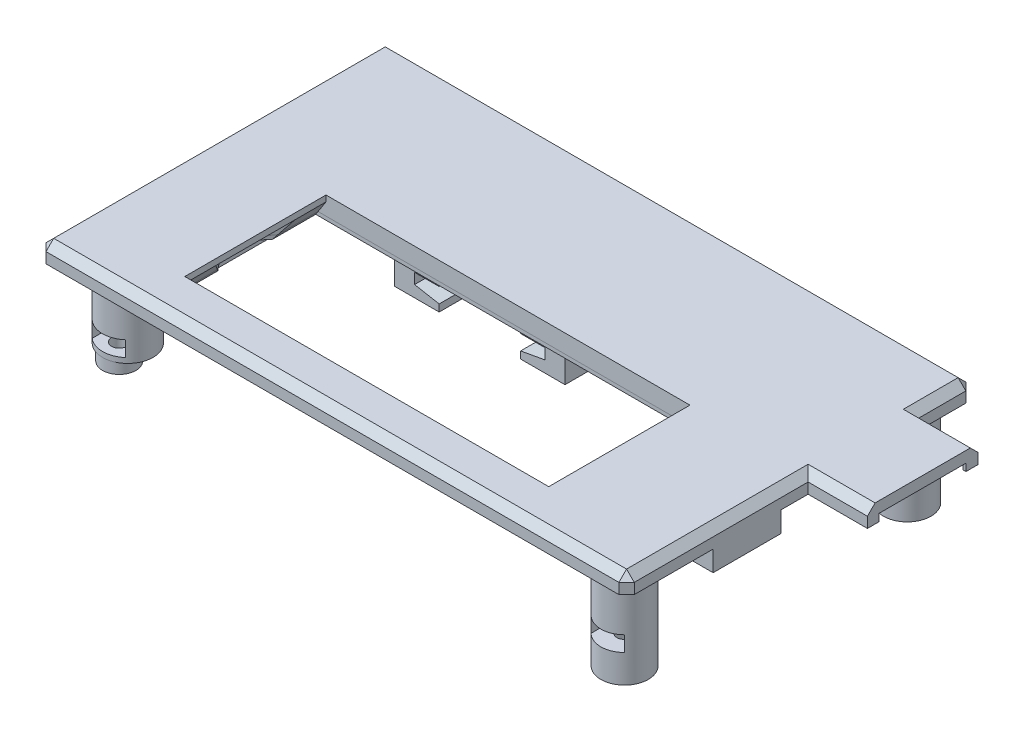
from build123d import *

# Parameters (mm, degrees)
SKETCH1_W                      = 116.713
SKETCH1_H                      = 68.834
BOSS_EXTRUDE1_DEPTH            = 3.629025
SKETCH32_W                     = 82.296
SKETCH32_H                     = 38.354
BOSS_EXTRUDE2_DEPTH            = 2.3622
SKETCH3_W                      = 72.2122
SKETCH3_H                      = 28.0162
LCD_WINDOW_DEPTH               = 122.968649856
LCD_BACKLIGHT_COVER_DEPTH      = 4.8006
SKETCH23_R                     = 1.016
LCD_MOUNTING_SCREW_HOLES_DEPTH = 4.975225
SKETCH8_W                      = 80.518
SKETCH8_H                      = 36.576
LCD_FACE_DEPTH                 = 122.898705176
SKETCH7_W                      = 96.6343
SKETCH7_H                      = 65.1764
SKETCH7_W_2                    = 95.0595
SKETCH7_H_2                    = 63.6016
RIDGE_INTO_BASE_DEPTH          = 1.190625
CLEAR_TILTED_LCD_DEPTH         = 28.0162
SKETCH5_W                      = 14.986
SKETCH5_H                      = 17.2212
F_9_PIN_IN_DEPTH               = 1.27
SKETCH4_W                      = 15.089010024
SKETCH4_H                      = 13.462
F_4_PIN_BACK_1_DEPTH           = 4.064
F_9_START                      = -15.6718
SKETCH40_W                     = 20.32
SKETCH40_H                     = 16.2687
F_9_PIN_OUT_DEPTH              = 15.6718
SKETCH10_W                     = 26.162
SKETCH10_H                     = 26.162
RTC_FLOOR_DEPTH                = 1.651
SKETCH11_R                     = 4.699
FASTENER_BOSSES_DEPTH          = 21.866225
SKETCH33_R                     = 3.302
BOSSES_TO_PCB_DEPTH            = 15.8877
COVER_NUTS_REACH               = 124.535
SKETCH34_R                     = 5.0038
COVER_NUTS_DIRECTION_2_DEPTH   = 4.064
SKETCH12_R                     = 1.524
SCREW_HOLES_DEPTH              = 18.2372
SKETCH13_W                     = 6.604
SKETCH13_H                     = 3.048
NUT_SLOT_1_DEPTH               = 7.112
SKETCH38_W                     = 6.604
SKETCH38_H                     = 3.048
NUT_SLOT_2_DEPTH               = 7.112
SKETCH39_W                     = 6.604
SKETCH39_H                     = 3.048
NUT_SLOT_3_DEPTH               = 7.112
SKETCH37_W                     = 6.604
SKETCH37_H                     = 3.048
NUT_SLOT_4_DEPTH               = 7.112
HEX_NUTS_DEPTH                 = 3.048
SKETCH41_W                     = 21.93925
SKETCH41_H                     = 3.629025
F_9_PIN_IN_LATCH_1_DEPTH       = 11.76655
SKETCH42_W                     = 11.1506
SKETCH42_H                     = 19.9136
F_9_PIN_LATCH_2_DEPTH          = 2.6162
SKETCH43_W                     = 17.2847
SKETCH43_H                     = 1.4478
F_9_PIN_LATCH_3_DEPTH          = 0.61595
CHAMFER1_SIZE                  = 1.524
SKETCH16_W                     = 8.8138
SKETCH16_H                     = 9.192
RTC_HOLDER_DEPTH               = 8.3185
RTC_HOLDER_2_DEPTH             = 8.3185
SKETCH25_W                     = 8.8138
SKETCH25_H                     = 2.54
RTC_HOLDER_2_2_DEPTH           = 4.191
RTC_SLOT_DEPTH                 = 9.192
CLEAR_MOLEX_PINS_REACH         = 125.741
SKETCH44_R                     = 2.1844
SKETCH45_R                     = 2.1844
CLEAR_MOLEX_PINS_2_DEPTH       = 5.08


with BuildPart() as part:
    # Sketch1 → Boss-Extrude1 (new body)
    with BuildSketch(Plane(origin=(0, 21.104225, 0), x_dir=(1, 0, 0), z_dir=(0, 1, 0))):
        with Locations((-43.9293, 31.75)):
            Rectangle(SKETCH1_W, SKETCH1_H)
    extrude(amount=-BOSS_EXTRUDE1_DEPTH)


with BuildPart() as body_2:
    # Sketch32 → Boss-Extrude2 (new body)
    with BuildSketch(Plane.XZ.offset(-17.4752)):
        with Locations((-45.085, -19.304)):
            Rectangle(SKETCH32_W, SKETCH32_H)
    extrude(amount=BOSS_EXTRUDE2_DEPTH)


with BuildPart() as lcd_window_tool:
    # Sketch3 → LCD window (new, through all)
    with BuildSketch(Plane(origin=(0, 21.104225, 0), x_dir=(1, 0, 0), z_dir=(0, 1, 0))):
        with Locations((-45.085, 19.304)):
            Rectangle(SKETCH3_W, SKETCH3_H)
    extrude(amount=-LCD_WINDOW_DEPTH)


with BuildPart() as part_1:
    add(part.part)

    # LCD window: cut by lcd_window_tool
    add(lcd_window_tool.part, mode=Mode.SUBTRACT)


with BuildPart() as body_2_1:
    add(body_2.part)

    # LCD window: cut by lcd_window_tool
    add(lcd_window_tool.part, mode=Mode.SUBTRACT)


with BuildPart() as lcd_backlight_cover_tool:
    # Sketch22 → LCD backlight cover (new body)
    with BuildSketch(Plane.XZ.offset(-15.113)):
        Polygon((-80.4799, -28.004466352), (-80.4799, -10.603533648), (-85.344, -16.417763969), (-85.344, -22.190236031), align=None)
        Polygon((-9.6901, -28.004466352), (-9.6901, -10.603533648), (-4.826, -16.417763969), (-4.826, -22.190236031), align=None)
    extrude(amount=-LCD_BACKLIGHT_COVER_DEPTH)


with BuildPart() as part_2:
    add(part_1.part)

    # LCD backlight cover: cut by lcd_backlight_cover_tool
    add(lcd_backlight_cover_tool.part, mode=Mode.SUBTRACT)


with BuildPart() as body_2_2:
    add(body_2_1.part)

    # LCD backlight cover: cut by lcd_backlight_cover_tool
    add(lcd_backlight_cover_tool.part, mode=Mode.SUBTRACT)


with BuildPart() as lcd_mounting_screw_holes_tool:
    # Sketch23 → LCD mounting screw holes (new body)
    with BuildSketch(Plane.XZ.offset(-15.113)):
        with Locations(Location((-82.55, -3.81, 0), (0, 0, 270))):
            Circle(SKETCH23_R)
        with Locations(Location((-82.55, -34.798, 0), (0, 0, 270))):
            Circle(SKETCH23_R)
        with Locations(Location((-7.62, -34.798, 0), (0, 0, 270))):
            Circle(SKETCH23_R)
        with Locations(Location((-7.62, -3.81, 0), (0, 0, 270))):
            Circle(SKETCH23_R)
    extrude(amount=-LCD_MOUNTING_SCREW_HOLES_DEPTH)


with BuildPart() as part_3:
    add(part_2.part)

    # LCD mounting screw holes: cut by lcd_mounting_screw_holes_tool
    add(lcd_mounting_screw_holes_tool.part, mode=Mode.SUBTRACT)

    # Sketch7 → ridge into base (add)
    with BuildSketch(Plane.XZ.offset(-17.4752)):
        with Locations((-50.09515, -31.2928)):
            Rectangle(SKETCH7_W, SKETCH7_H)
        with Locations((-50.09515, -31.2928)):
            Rectangle(SKETCH7_W_2, SKETCH7_H_2, mode=Mode.SUBTRACT)
    extrude(amount=RIDGE_INTO_BASE_DEPTH)


with BuildPart() as body_2_3:
    add(body_2_2.part)

    # LCD mounting screw holes: cut by lcd_mounting_screw_holes_tool
    add(lcd_mounting_screw_holes_tool.part, mode=Mode.SUBTRACT)

    # Sketch8 → LCD face (cut, through all)
    with BuildSketch(Plane.XZ.offset(-16.764)):
        with Locations((-45.085, -19.304)):
            Rectangle(SKETCH8_W, SKETCH8_H)
    extrude(amount=LCD_FACE_DEPTH, mode=Mode.SUBTRACT)


with BuildPart() as clear_tilted_lcd_tool:
    # Sketch29 → clear tilted LCD (new body)
    with BuildSketch(Plane(origin=(0, 0, -5.2959), x_dir=(-1, 0, 0), z_dir=(0, 0, -1))):
        Polygon((8.9789, 19.9136), (8.9789, 16.764), (6.9469, 16.764), align=None)
        Polygon((81.1911, 16.764), (81.1911, 19.9136), (83.2231, 16.764), align=None)
    extrude(amount=CLEAR_TILTED_LCD_DEPTH)


with BuildPart() as part_4:
    add(part_3.part)

    # clear tilted LCD: cut by clear_tilted_lcd_tool
    add(clear_tilted_lcd_tool.part, mode=Mode.SUBTRACT)

    # Sketch5 → 9 pin in (cut)
    with BuildSketch(Plane.XZ.offset(-17.4752)):
        with Locations((7.1882, -43.8912)):
            Rectangle(SKETCH5_W, SKETCH5_H)
    extrude(amount=-F_9_PIN_IN_DEPTH, mode=Mode.SUBTRACT)

    # Sketch4 → 4 pin back 1 (add)
    with BuildSketch(Plane.XZ.offset(-17.4752)):
        with Locations((6.882694988, -21.2344)):
            Rectangle(SKETCH4_W, SKETCH4_H)
    extrude(amount=F_4_PIN_BACK_1_DEPTH)

    # Sketch40 → 9 pin out (cut)
    with BuildSketch(Plane.ZY.offset(102.2858).offset(F_9_START)):
        with Locations((-44.3992, 9.59485)):
            Rectangle(SKETCH40_W, SKETCH40_H)
    extrude(amount=F_9_PIN_OUT_DEPTH, mode=Mode.SUBTRACT)

    # Sketch11 → fastener bosses (add)
    with BuildSketch(Plane(origin=(0, 21.104225, 0), x_dir=(1, 0, 0), z_dir=(0, 1, 0))):
        with Locations(Location((7.4676, 3.8989, 0), (0, 0, 270))):
            Circle(SKETCH11_R)
        with Locations(Location((7.4676, 59.9821, 0), (0, 0, 270))):
            Circle(SKETCH11_R)
    extrude(amount=-FASTENER_BOSSES_DEPTH)

    # Sketch33 → bosses to PCB (add)
    with BuildSketch(Plane(origin=(0, 1.5875, 0), x_dir=(1, 0, 0), z_dir=(0, 1, 0))):
        with Locations(Location((-92.71, 59.69, 0), (0, 0, 270))):
            Circle(SKETCH33_R)
        with Locations(Location((-92.71, 3.81, 0), (0, 0, 270))):
            Circle(SKETCH33_R)
    extrude(amount=BOSSES_TO_PCB_DEPTH)

    # cover nuts: up to this face of the body (flat: up to its plane)
    cover_nuts_end = Plane(part_4.part.faces().sort_by_distance((-49.690451671, 17.4752, -37.724869944))[0])
    # Sketch34 → cover nuts (add, up to the picked face)
    with BuildSketch(Plane(origin=(0, 7.896225, 0), x_dir=(1, 0, 0), z_dir=(0, 1, 0)), mode=Mode.PRIVATE) as cover_nuts_sk1:
        with Locations(Location((-92.71, 57.9882, 0), (0, 0, 316.742432355))):
            Circle(SKETCH34_R)
    cover_nuts_tool1 = split(extrude(cover_nuts_sk1.sketch, amount=COVER_NUTS_REACH, mode=Mode.PRIVATE), bisect_by=cover_nuts_end, keep=Keep.BOTH, mode=Mode.PRIVATE)
    # Sketch34 → cover nuts (add, up to the picked face)
    with BuildSketch(Plane(origin=(0, 7.896225, 0), x_dir=(1, 0, 0), z_dir=(0, 1, 0)), mode=Mode.PRIVATE) as cover_nuts_sk2:
        with Locations(Location((-92.71, 5.5118, 0), (0, 0, 270))):
            Circle(SKETCH34_R)
    cover_nuts_tool2 = split(extrude(cover_nuts_sk2.sketch, amount=COVER_NUTS_REACH, mode=Mode.PRIVATE), bisect_by=cover_nuts_end, keep=Keep.BOTH, mode=Mode.PRIVATE)
    add(cover_nuts_tool1.solids().sort_by(Axis((-92.71, 7.896225, -57.9882), (0, 1, 0)))[0])
    add(cover_nuts_tool2.solids().sort_by(Axis((-92.71, 7.896225, -5.5118), (0, 1, 0)))[0])

    # Sketch34 → cover nuts direction 2 (add)
    with BuildSketch(Plane(origin=(0, 7.896225, 0), x_dir=(1, 0, 0), z_dir=(0, 1, 0))):
        with Locations(Location((-92.71, 57.9882, 0), (0, 0, 316.742432355))):
            Circle(SKETCH34_R)
        with Locations(Location((-92.71, 5.5118, 0), (0, 0, 270))):
            Circle(SKETCH34_R)
    extrude(amount=-COVER_NUTS_DIRECTION_2_DEPTH)

    # Sketch12 → screw holes (cut)
    with BuildSketch(Plane.XZ.offset(0.762)):
        with Locations(Location((-92.71, -3.81, 0), (0, 0, 90))):
            Circle(SKETCH12_R)
        with Locations(Location((7.4676, -3.8989, 0), (0, 0, 270))):
            Circle(SKETCH12_R)
        with Locations(Location((7.4676, -59.9821, 0), (0, 0, 270))):
            Circle(SKETCH12_R)
        with Locations(Location((-92.71, -59.69, 0), (0, 0, 90))):
            Circle(SKETCH12_R)
    extrude(amount=-SCREW_HOLES_DEPTH, mode=Mode.SUBTRACT)

    # Sketch13 → nut slot 1 (cut)
    with BuildSketch(Plane.XY.offset(-64.6811)):
        with Locations((7.4676, 6.372225)):
            Rectangle(SKETCH13_W, SKETCH13_H)
    extrude(amount=NUT_SLOT_1_DEPTH, mode=Mode.SUBTRACT)

    # Sketch38 → nut slot 2 (cut)
    with BuildSketch(Plane(origin=(0, 0, -62.992), x_dir=(-1, 0, 0), z_dir=(0, 0, -1))):
        with Locations((92.71, 6.372225)):
            Rectangle(SKETCH38_W, SKETCH38_H)
    extrude(amount=-NUT_SLOT_2_DEPTH, mode=Mode.SUBTRACT)

    # Sketch39 → nut slot 3 (cut)
    with BuildSketch(Plane.XY.offset(0.8001)):
        with Locations((7.4676, 6.372225)):
            Rectangle(SKETCH39_W, SKETCH39_H)
    extrude(amount=-NUT_SLOT_3_DEPTH, mode=Mode.SUBTRACT)

    # Sketch37 → nut slot 4 (cut)
    with BuildSketch(Plane(origin=(0, 0, -0.508), x_dir=(-1, 0, 0), z_dir=(0, 0, -1))):
        with Locations((92.71, 6.372225)):
            Rectangle(SKETCH37_W, SKETCH37_H)
    extrude(amount=NUT_SLOT_4_DEPTH, mode=Mode.SUBTRACT)

    # Sketch17 → hex nuts (cut)
    with BuildSketch(Plane(origin=(0, 7.896225, 0), x_dir=(-1, 0, 0), z_dir=(0, 1, 0))):
        Polygon((-10.7696, -5.805310589), (-7.4676, -7.711721178), (-4.1656, -5.805310589), (-4.1656, -1.992489411), (-7.4676, -0.086078822), (-10.7696, -1.992489411), align=None)
        Polygon((-10.7696, -61.888510589), (-7.4676, -63.794921178), (-4.1656, -61.888510589), (-4.1656, -58.075689411), (-7.4676, -56.169278822), (-10.7696, -58.075689411), align=None)
        Polygon((92.71, -55.877178822), (89.408, -57.783589411), (89.408, -61.596410589), (92.71, -63.502821178), (96.012, -61.596410589), (96.012, -57.783589411), align=None)
        Polygon((92.71, 0.002821178), (89.408, -1.903589411), (89.408, -5.716410589), (92.71, -7.622821178), (96.012, -5.716410589), (96.012, -1.903589411), align=None)
    extrude(amount=-HEX_NUTS_DEPTH, mode=Mode.SUBTRACT)

    # Sketch41 → 9 pin in latch 1 (add)
    with BuildSketch(Plane(origin=(14.4272, 0, 0), x_dir=(0, 0, -1), z_dir=(1, 0, 0))):
        with Locations((44.323, 19.2897125)):
            Rectangle(SKETCH41_W, SKETCH41_H)
    extrude(amount=F_9_PIN_IN_LATCH_1_DEPTH)

    # Sketch42 → 9 pin latch 2 (cut)
    with BuildSketch(Plane.XZ.offset(-17.4752)):
        with Locations((20.0025, -44.323)):
            Rectangle(SKETCH42_W, SKETCH42_H)
    extrude(amount=-F_9_PIN_LATCH_2_DEPTH, mode=Mode.SUBTRACT)

    # Sketch43 → 9 pin latch 3 (cut)
    with BuildSketch(Plane(origin=(26.19375, 0, 0), x_dir=(0, 0, -1), z_dir=(1, 0, 0))):
        with Locations((44.26585, 18.1991)):
            Rectangle(SKETCH43_W, SKETCH43_H)
    extrude(amount=-F_9_PIN_LATCH_3_DEPTH, mode=Mode.SUBTRACT)

    # Chamfer1
    chamfer1_edges = [part_4.edges().sort_by_distance(p)[0] for p in [
        (-102.2858, 19.2897125, 2.667),
        (14.4272, 19.2897125, 2.667),
        (14.4272, 19.2897125, -66.167),
        (-102.2858, 19.2897125, -66.167),
        (-43.9293, 21.104225, -66.167),
        (14.4272, 21.104225, -60.7298125),
        (20.310475, 21.104225, -55.292625),
        (20.310475, 21.104225, -33.353375),
        (14.4272, 21.104225, -15.3431875),
        (-43.9293, 21.104225, 2.667),
        (-102.2858, 21.104225, -31.75),
    ]]
    chamfer(chamfer1_edges, length=CHAMFER1_SIZE)

    # Sketch25 → RTC holder 2 2 (add)
    with BuildSketch(Plane.XZ.offset(-16.764)):
        with Locations((-41.9439, -62.269597859)):
            Rectangle(SKETCH25_W, SKETCH25_H)
        with Locations((-66.9121, -62.269597859)):
            Rectangle(SKETCH25_W, SKETCH25_H)
    extrude(amount=RTC_HOLDER_2_2_DEPTH)

    # clear molex pins: up to this face of the body (flat: up to its plane)
    clear_molex_pins_end = Plane(part_4.part.faces().sort_by_distance((-2.5654, 16.8798875, -31.2928))[0])
    # Sketch44 → clear molex pins (cut, up to the picked face)
    with BuildSketch(Plane.ZY.offset(-0.127), mode=Mode.PRIVATE) as clear_molex_pins_sk1:
        with Locations((-48.8188, 15.6972)):
            Circle(SKETCH44_R)
    clear_molex_pins_tool1 = split(extrude(clear_molex_pins_sk1.sketch, amount=CLEAR_MOLEX_PINS_REACH, mode=Mode.PRIVATE), bisect_by=clear_molex_pins_end, keep=Keep.BOTH, mode=Mode.PRIVATE)
    # Sketch44 → clear molex pins (cut, up to the picked face)
    with BuildSketch(Plane.ZY.offset(-0.127), mode=Mode.PRIVATE) as clear_molex_pins_sk2:
        with Locations((-43.7896, 15.6972)):
            Circle(SKETCH44_R)
    clear_molex_pins_tool2 = split(extrude(clear_molex_pins_sk2.sketch, amount=CLEAR_MOLEX_PINS_REACH, mode=Mode.PRIVATE), bisect_by=clear_molex_pins_end, keep=Keep.BOTH, mode=Mode.PRIVATE)
    # Sketch44 → clear molex pins (cut, up to the picked face)
    with BuildSketch(Plane.ZY.offset(-0.127), mode=Mode.PRIVATE) as clear_molex_pins_sk3:
        with Locations((-38.7604, 15.6972)):
            Circle(SKETCH44_R)
    clear_molex_pins_tool3 = split(extrude(clear_molex_pins_sk3.sketch, amount=CLEAR_MOLEX_PINS_REACH, mode=Mode.PRIVATE), bisect_by=clear_molex_pins_end, keep=Keep.BOTH, mode=Mode.PRIVATE)
    add(clear_molex_pins_tool1.solids().sort_by(Axis((0.127, 15.6972, -48.8188), (-1, 0, 0)))[0], mode=Mode.SUBTRACT)
    add(clear_molex_pins_tool2.solids().sort_by(Axis((0.127, 15.6972, -43.7896), (-1, 0, 0)))[0], mode=Mode.SUBTRACT)
    add(clear_molex_pins_tool3.solids().sort_by(Axis((0.127, 15.6972, -38.7604), (-1, 0, 0)))[0], mode=Mode.SUBTRACT)


with BuildPart() as body_2_4:
    add(body_2_3.part)

    # clear tilted LCD: cut by clear_tilted_lcd_tool
    add(clear_tilted_lcd_tool.part, mode=Mode.SUBTRACT)

    # Sketch10 → rtc floor (cut)
    with BuildSketch(Plane.XZ.offset(-16.764)):
        with Locations((-54.428, -49.784)):
            Rectangle(SKETCH10_W, SKETCH10_H)
    extrude(amount=RTC_FLOOR_DEPTH, mode=Mode.SUBTRACT)


with BuildPart() as body_3:
    # Sketch16 → RTC holder (new body)
    with BuildSketch(Plane.XZ.offset(-16.764)):
        with Locations((-66.9121, -41.68)):
            Rectangle(SKETCH16_W, SKETCH16_H)
    extrude(amount=RTC_HOLDER_DEPTH)


with BuildPart() as body_4:
    # Sketch16 → RTC holder 2 (new body)
    with BuildSketch(Plane.XZ.offset(-16.764)):
        with Locations((-41.9439, -41.68)):
            Rectangle(SKETCH16_W, SKETCH16_H)
    extrude(amount=RTC_HOLDER_2_DEPTH)


with BuildPart() as rtc_slot_tool:
    # Sketch21 → RTC slot (new body)
    with BuildSketch(Plane.XY.offset(-37.084)):
        Polygon((-62.5052, 9.8425), (-62.5052, 7.3025), (-46.3508, 7.3025), (-46.3508, 9.8425), (-41.474, 10.7315), (-41.474, 12.827), (-67.382, 12.827), (-67.382, 10.7315), align=None)
    extrude(amount=-RTC_SLOT_DEPTH)


with BuildPart() as body_3_1:
    add(body_3.part)

    # RTC slot: cut by rtc_slot_tool
    add(rtc_slot_tool.part, mode=Mode.SUBTRACT)


with BuildPart() as body_4_1:
    add(body_4.part)

    # RTC slot: cut by rtc_slot_tool
    add(rtc_slot_tool.part, mode=Mode.SUBTRACT)


with BuildPart() as clear_molex_pins_2_tool:
    # Sketch45 → clear molex pins 2 (new body)
    with BuildSketch(Plane(origin=(-86.868, 0, 0), x_dir=(0, 0, -1), z_dir=(1, 0, 0))):
        with Locations((48.9458, 15.6972)):
            Circle(SKETCH45_R)
        with Locations((43.9166, 15.6972)):
            Circle(SKETCH45_R)
        with Locations((38.8874, 15.6972)):
            Circle(SKETCH45_R)
    extrude(amount=CLEAR_MOLEX_PINS_2_DEPTH)


with BuildPart() as part_5:
    add(part_4.part)

    # clear molex pins 2: cut by clear_molex_pins_2_tool
    add(clear_molex_pins_2_tool.part, mode=Mode.SUBTRACT)


with BuildPart() as body_2_5:
    add(body_2_4.part)

    # clear molex pins 2: cut by clear_molex_pins_2_tool
    add(clear_molex_pins_2_tool.part, mode=Mode.SUBTRACT)


solid = Compound([body_3_1.part, body_4_1.part, part_5.part, body_2_5.part])
